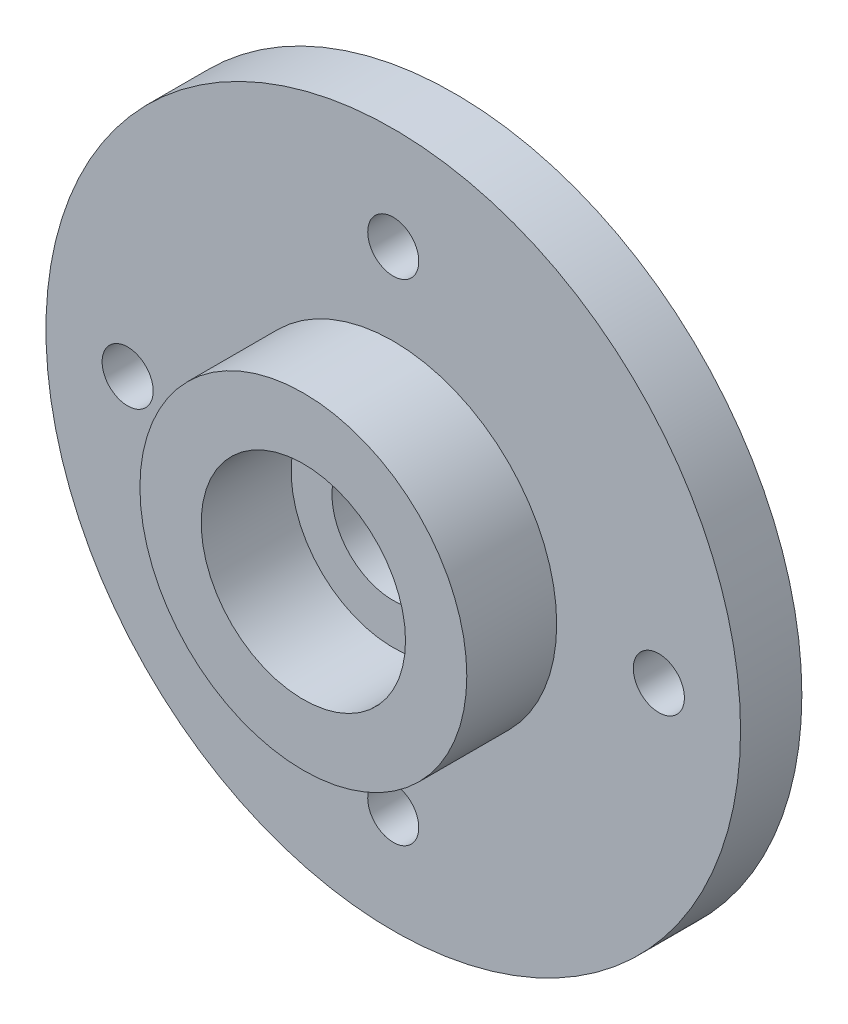
from build123d import *

# Parameters (mm, degrees)
SKETCH1_R           = 8.5
BOSS_EXTRUDE1_DEPTH = 1.5
SKETCH2_R           = 4
SKETCH2_R_2         = 2.5
BOSS_EXTRUDE2_DEPTH = 3.7
SKETCH3_R           = 1.5
CUT_EXTRUDE1_DEPTH  = 2
SKETCH4_R           = 0.625
CUT_EXTRUDE2_DEPTH  = 2
CIRPATTERN1_COUNT   = 2
SKETCH5_R           = 0.625
CUT_EXTRUDE3_DEPTH  = 1.5
SKETCH6_R           = 3.5
SKETCH6_R_2         = 3
BOSS_EXTRUDE3_DEPTH = 1


with BuildPart() as part:
    # Sketch1 → Boss-Extrude1 (new body)
    with BuildSketch(Plane.XY):
        Circle(SKETCH1_R)
    extrude(amount=BOSS_EXTRUDE1_DEPTH)

    # Sketch2 → Boss-Extrude2 (add)
    with BuildSketch(Plane.XY):
        Circle(SKETCH2_R)
        Circle(SKETCH2_R_2, mode=Mode.SUBTRACT)
    extrude(amount=BOSS_EXTRUDE2_DEPTH)

    # Sketch3 → Cut-Extrude1 (cut)
    with BuildSketch(Plane.XY):
        Circle(SKETCH3_R)
    extrude(amount=CUT_EXTRUDE1_DEPTH, mode=Mode.SUBTRACT)

    # Sketch4 → Cut-Extrude2 (cut)
    with BuildSketch(Plane.XY):
        with Locations((6.5, 0)):
            Circle(SKETCH4_R)
    cut_extrude2 = extrude(amount=CUT_EXTRUDE2_DEPTH, mode=Mode.SUBTRACT)

    # CirPattern1: Cut-Extrude2 ×2 about axis
    cirpattern1_axis = Axis((0, 0, 0), (0, 0, 1))
    for i in range(1, CIRPATTERN1_COUNT):
        add(cut_extrude2.rotate(cirpattern1_axis, i * 360 / CIRPATTERN1_COUNT), mode=Mode.SUBTRACT)

    # Sketch5 → Cut-Extrude3 (cut)
    with BuildSketch(Plane(origin=(0, 0, 0), x_dir=(-1, 0, 0), z_dir=(0, 0, -1))):
        with Locations((0, 6)):
            Circle(SKETCH5_R)
        with Locations((0, -6)):
            Circle(SKETCH5_R)
    extrude(amount=-CUT_EXTRUDE3_DEPTH, mode=Mode.SUBTRACT)

    # Sketch6 → Boss-Extrude3 (add)
    with BuildSketch(Plane(origin=(0, 0, 0), x_dir=(-1, 0, 0), z_dir=(0, 0, -1))):
        with Locations(Location((0, 0, 0), (0, 0, 180))):
            Circle(SKETCH6_R)
        Circle(SKETCH6_R_2, mode=Mode.SUBTRACT)
    extrude(amount=BOSS_EXTRUDE3_DEPTH)


solid = part.part
